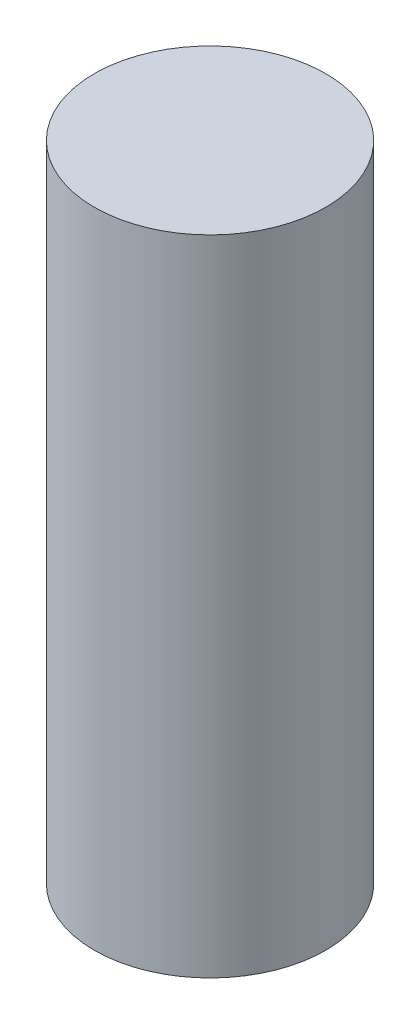
from build123d import *

# Parameters (mm, degrees)
SKETCH1_R           = 4
BOSS_EXTRUDE1_DEPTH = 22.239986


with BuildPart() as part:
    # Sketch1 → Boss-Extrude1 (new body)
    with BuildSketch(Plane(origin=(0, 0, 0), x_dir=(1, 0, 0), z_dir=(0, 1, 0))):
        with Locations(Location((0, 0, 0), (0, 0, 270))):
            Circle(SKETCH1_R)
    extrude(amount=BOSS_EXTRUDE1_DEPTH)


solid = part.part
